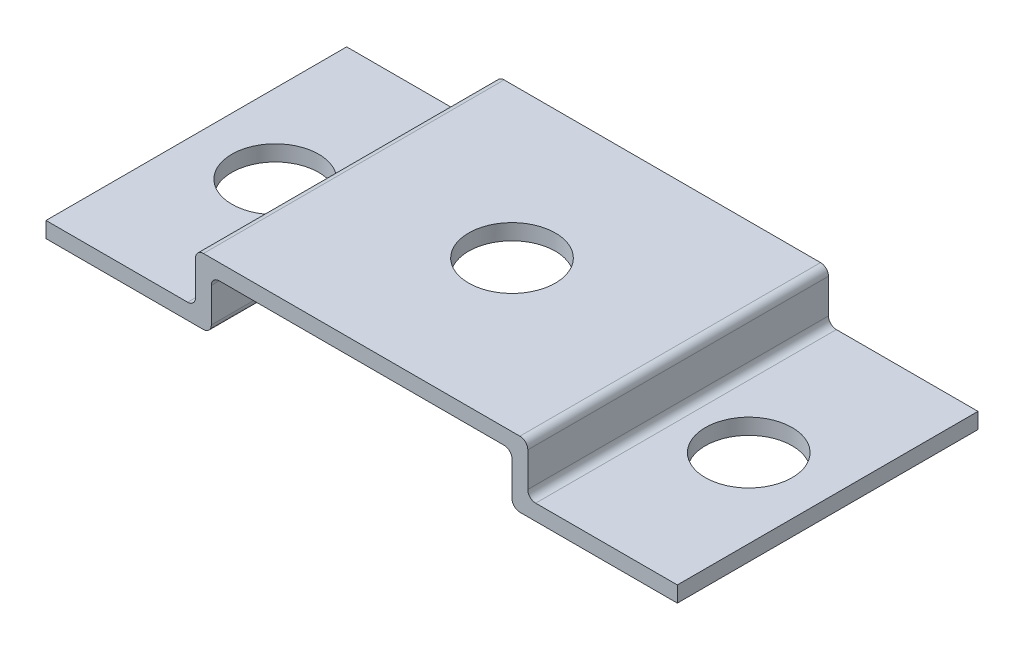
from build123d import *

# Parameters (mm, degrees)
BOSS_EXTRUDE1_DEPTH = 19.05
FILLET1_R           = 0.5
SKETCH3_R           = 2.75
CUT_EXTRUDE1_DEPTH  = 45.418274674
SKETCH4_R           = 2.75
CUT_EXTRUDE2_DEPTH  = 45.500933979


with BuildPart() as part:
    # Sketch1 → Boss-Extrude1 (new body)
    with BuildSketch(Plane.XY):
        Polygon((0, 0), (9.475, 0), (9.475, 3.175), (30.525, 3.175), (30.525, 0), (40, 0), (40, -1), (29.525, -1), (29.525, 2.175), (10.475, 2.175), (10.475, -1), (0, -1), align=None)
    extrude(amount=-BOSS_EXTRUDE1_DEPTH)

    # Fillet1
    fillet1_edges = [part.edges().sort_by_distance(p)[0] for p in [
        (9.475, 0, -9.525),
        (9.475, 3.175, -9.525),
        (30.525, 3.175, -9.525),
        (30.525, 0, -9.525),
        (29.525, -1, -9.525),
        (29.525, 2.175, -9.525),
        (10.475, 2.175, -9.525),
        (10.475, -1, -9.525),
    ]]
    fillet(fillet1_edges, radius=FILLET1_R)

    # Sketch3 → Cut-Extrude1 (cut, through all)
    with BuildSketch(Plane(origin=(0, 0, 0), x_dir=(1, 0, 0), z_dir=(0, 1, 0))):
        with Locations(Location((5, 9.525, 0), (0, 0, 270))):
            Circle(SKETCH3_R)
        with Locations(Location((35, 9.525, 0), (0, 0, 90))):
            Circle(SKETCH3_R)
    extrude(amount=-CUT_EXTRUDE1_DEPTH, mode=Mode.SUBTRACT)

    # Sketch4 → Cut-Extrude2 (cut, through all)
    with BuildSketch(Plane(origin=(0, 3.175, 0), x_dir=(1, 0, 0), z_dir=(0, 1, 0))):
        with Locations(Location((20, 9.525, 0), (0, 0, 270))):
            Circle(SKETCH4_R)
    extrude(amount=-CUT_EXTRUDE2_DEPTH, mode=Mode.SUBTRACT)


solid = part.part
